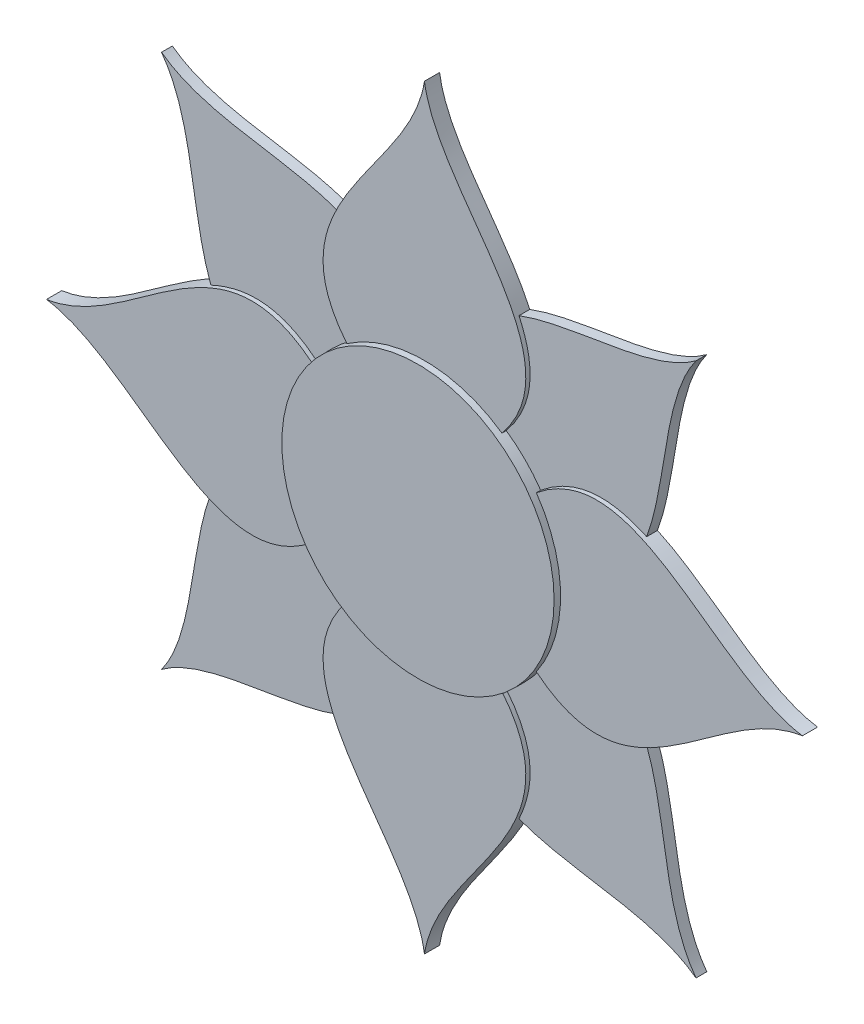
from build123d import *

# Parameters (mm, degrees)
BOSS_EXTRUDE1_DEPTH = 10
BOSS_EXTRUDE2_DEPTH = 7
BOSS_EXTRUDE3_DEPTH = 5


with BuildPart() as part:
    # Sketch1 → Boss-Extrude1 (new body)
    with BuildSketch(Plane.XY):
        with BuildLine():
            ThreePointArc((51.791249261, -35.872667893), (60.133623009, -18.79173184), (63.001442855, 0))
            ThreePointArc((63.001442855, 0), (60.133623009, 18.79173184), (51.791249261, 35.872667893))
            ThreePointArc((51.791249261, 35.872667893), (44.548747467, 44.548747467), (35.872667893, 51.791249261))
            ThreePointArc((35.872667893, 51.791249261), (0, 63.001442855), (-35.872667893, 51.791249261))
            ThreePointArc((-35.872667893, 51.791249261), (-44.548747467, 44.548747467), (-51.791249261, 35.872667893))
            ThreePointArc((-51.791249261, 35.872667893), (-63.001442855, 0), (-51.791249261, -35.872667893))
            ThreePointArc((-51.791249261, -35.872667893), (-44.548747467, -44.548747467), (-35.872667893, -51.791249261))
            ThreePointArc((-35.872667893, -51.791249261), (0, -63.001442855), (35.872667893, -51.791249261))
            ThreePointArc((35.872667893, -51.791249261), (44.548747467, -44.548747467), (51.791249261, -35.872667893))
        make_face()
    extrude(amount=BOSS_EXTRUDE1_DEPTH)

    # Sketch1<3> → Boss-Extrude2 (add)
    with BuildSketch(Plane.XY):
        with BuildLine():
            ThreePointArc((51.791249261, 35.872667893), (63.001442855, 0), (51.791249261, -35.872667893))
            add(Edge.make_bspline(
                [(51.791249261, -35.872667893), (96.722520649, -72.648743073), (133.625302995, -6.166423411), (174.887829117, 0)],
                knots=[0, 0, 0, 0, 1, 1, 1, 1], degree=3))
            add(Edge.make_bspline(
                [(174.887829117, 0), (133.625302995, 6.166423411), (96.722520649, 72.648743073), (51.791249261, 35.872667893)],
                knots=[0.38504414, 0.38504414, 0.38504414, 0.38504414, 1.38504414, 1.38504414, 1.38504414, 1.38504414], degree=3))
        make_face()
        with BuildLine():
            ThreePointArc((-35.872667893, 51.791249261), (0, 63.001442855), (35.872667893, 51.791249261))
            add(Edge.make_bspline(
                [(35.872667893, 51.791249261), (72.648743073, 96.722520649), (6.166423411, 133.625302995), (0, 174.887829117)],
                knots=[0, 0, 0, 0, 1, 1, 1, 1], degree=3))
            add(Edge.make_bspline(
                [(0, 174.887829117), (-6.166423411, 133.625302995), (-72.648743073, 96.722520649), (-35.872667893, 51.791249261)],
                knots=[0.38504414, 0.38504414, 0.38504414, 0.38504414, 1.38504414, 1.38504414, 1.38504414, 1.38504414], degree=3))
        make_face()
        with BuildLine():
            add(Edge.make_bspline(
                [(0, -174.887829117), (6.166423411, -133.625302995), (72.648743073, -96.722520649), (35.872667893, -51.791249261)],
                knots=[0.38504414, 0.38504414, 0.38504414, 0.38504414, 1.38504414, 1.38504414, 1.38504414, 1.38504414], degree=3))
            ThreePointArc((35.872667893, -51.791249261), (0, -63.001442855), (-35.872667893, -51.791249261))
            add(Edge.make_bspline(
                [(-35.872667893, -51.791249261), (-72.648743073, -96.722520649), (-6.166423411, -133.625302995), (0, -174.887829117)],
                knots=[0, 0, 0, 0, 1, 1, 1, 1], degree=3))
        make_face()
        with BuildLine():
            ThreePointArc((-51.791249261, -35.872667893), (-63.001442855, 0), (-51.791249261, 35.872667893))
            add(Edge.make_bspline(
                [(-51.791249261, 35.872667893), (-96.722520649, 72.648743073), (-133.625302995, 6.166423411), (-174.887829117, 0)],
                knots=[0, 0, 0, 0, 1, 1, 1, 1], degree=3))
            add(Edge.make_bspline(
                [(-174.887829117, 0), (-133.625302995, -6.166423411), (-96.722520649, -72.648743073), (-51.791249261, -35.872667893)],
                knots=[0.38504414, 0.38504414, 0.38504414, 0.38504414, 1.38504414, 1.38504414, 1.38504414, 1.38504414], degree=3))
        make_face()
    extrude(amount=BOSS_EXTRUDE2_DEPTH)

    # Sketch1<4> → Boss-Extrude3 (add)
    with BuildSketch(Plane.XY):
        with BuildLine():
            ThreePointArc((35.872667893, 51.791249261), (44.548747467, 44.548747467), (51.791249261, 35.872667893))
            add(Edge.make_bspline(
                [(51.791249261, 35.872667893), (69.091772014, 50.033080135), (85.201999092, 48.884507071), (100.829128316, 41.764792431)],
                knots=[0, 0, 0, 0, 0.38504414, 0.38504414, 0.38504414, 0.38504414], degree=3))
            add(Edge.make_bspline(
                [(100.829128316, 41.764792431), (110.436752916, 67.453341468), (108.403199611, 103.040391174), (123.664369915, 123.664369915)],
                knots=[0.38504414, 0.38504414, 0.38504414, 0.38504414, 1, 1, 1, 1], degree=3))
            add(Edge.make_bspline(
                [(41.764792431, 100.829128316), (67.453341468, 110.436752916), (103.040391174, 108.403199611), (123.664369915, 123.664369915)],
                knots=[0.38504414, 0.38504414, 0.38504414, 0.38504414, 1, 1, 1, 1], degree=3))
            add(Edge.make_bspline(
                [(35.872667893, 51.791249261), (50.033080135, 69.091772014), (48.884507071, 85.201999092), (41.764792431, 100.829128316)],
                knots=[0, 0, 0, 0, 0.38504414, 0.38504414, 0.38504414, 0.38504414], degree=3))
        make_face()
        with BuildLine():
            add(Edge.make_bspline(
                [(51.791249261, -35.872667893), (69.091772014, -50.033080135), (85.201999092, -48.884507071), (100.829128316, -41.764792431)],
                knots=[0, 0, 0, 0, 0.38504414, 0.38504414, 0.38504414, 0.38504414], degree=3))
            ThreePointArc((51.791249261, -35.872667893), (44.548747467, -44.548747467), (35.872667893, -51.791249261))
            add(Edge.make_bspline(
                [(35.872667893, -51.791249261), (50.033080135, -69.091772014), (48.884507071, -85.201999092), (41.764792431, -100.829128316)],
                knots=[0, 0, 0, 0, 0.38504414, 0.38504414, 0.38504414, 0.38504414], degree=3))
            add(Edge.make_bspline(
                [(41.764792431, -100.829128316), (67.453341468, -110.436752916), (103.040391174, -108.403199611), (123.664369915, -123.664369915)],
                knots=[0.38504414, 0.38504414, 0.38504414, 0.38504414, 1, 1, 1, 1], degree=3))
            add(Edge.make_bspline(
                [(100.829128316, -41.764792431), (110.436752916, -67.453341468), (108.403199611, -103.040391174), (123.664369915, -123.664369915)],
                knots=[0.38504414, 0.38504414, 0.38504414, 0.38504414, 1, 1, 1, 1], degree=3))
        make_face()
        with BuildLine():
            ThreePointArc((-51.791249261, 35.872667893), (-44.548747467, 44.548747467), (-35.872667893, 51.791249261))
            add(Edge.make_bspline(
                [(-35.872667893, 51.791249261), (-50.033080135, 69.091772014), (-48.884507071, 85.201999092), (-41.764792431, 100.829128316)],
                knots=[0, 0, 0, 0, 0.38504414, 0.38504414, 0.38504414, 0.38504414], degree=3))
            add(Edge.make_bspline(
                [(-41.764792431, 100.829128316), (-67.453341468, 110.436752916), (-103.040391174, 108.403199611), (-123.664369915, 123.664369915)],
                knots=[0.38504414, 0.38504414, 0.38504414, 0.38504414, 1, 1, 1, 1], degree=3))
            add(Edge.make_bspline(
                [(-100.829128316, 41.764792431), (-110.436752916, 67.453341468), (-108.403199611, 103.040391174), (-123.664369915, 123.664369915)],
                knots=[0.38504414, 0.38504414, 0.38504414, 0.38504414, 1, 1, 1, 1], degree=3))
            add(Edge.make_bspline(
                [(-51.791249261, 35.872667893), (-69.091772014, 50.033080135), (-85.201999092, 48.884507071), (-100.829128316, 41.764792431)],
                knots=[0, 0, 0, 0, 0.38504414, 0.38504414, 0.38504414, 0.38504414], degree=3))
        make_face()
        with BuildLine():
            add(Edge.make_bspline(
                [(-35.872667893, -51.791249261), (-50.033080135, -69.091772014), (-48.884507071, -85.201999092), (-41.764792431, -100.829128316)],
                knots=[0, 0, 0, 0, 0.38504414, 0.38504414, 0.38504414, 0.38504414], degree=3))
            ThreePointArc((-35.872667893, -51.791249261), (-44.548747467, -44.548747467), (-51.791249261, -35.872667893))
            add(Edge.make_bspline(
                [(-51.791249261, -35.872667893), (-69.091772014, -50.033080135), (-85.201999092, -48.884507071), (-100.829128316, -41.764792431)],
                knots=[0, 0, 0, 0, 0.38504414, 0.38504414, 0.38504414, 0.38504414], degree=3))
            add(Edge.make_bspline(
                [(-100.829128316, -41.764792431), (-110.436752916, -67.453341468), (-108.403199611, -103.040391174), (-123.664369915, -123.664369915)],
                knots=[0.38504414, 0.38504414, 0.38504414, 0.38504414, 1, 1, 1, 1], degree=3))
            add(Edge.make_bspline(
                [(-41.764792431, -100.829128316), (-67.453341468, -110.436752916), (-103.040391174, -108.403199611), (-123.664369915, -123.664369915)],
                knots=[0.38504414, 0.38504414, 0.38504414, 0.38504414, 1, 1, 1, 1], degree=3))
        make_face()
    extrude(amount=BOSS_EXTRUDE3_DEPTH)


solid = part.part
